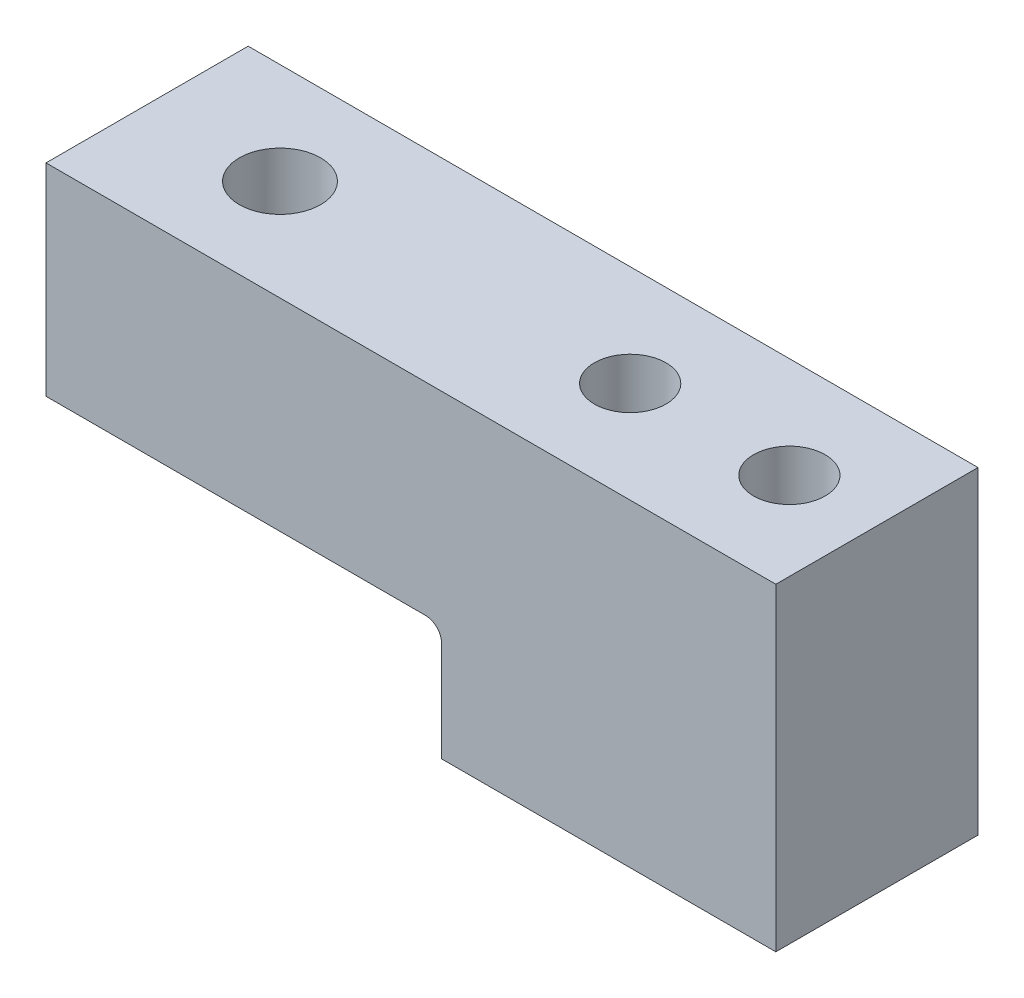
from build123d import *

# Parameters (mm, degrees)
BOSS_EXTRUDE1_DEPTH         = 12.7
M4_CLEARANCE_HOLE1_D        = 4.5
TAP_DRILL_FOR_1_4_20_TAP1_D = 5.1054


with BuildPart() as part:
    # Sketch1 → Boss-Extrude1 (new body)
    with BuildSketch(Plane.XY):
        with BuildLine():
            Line((0, 0), (21, 0))
            Line((21, 0), (21, 20))
            Line((21, 20), (-24.85, 20))
            Line((-24.85, 20), (-24.85, 7.3))
            Line((-24.85, 7.3), (-1, 7.3))
            ThreePointArc((-1, 7.3), (-0.292893219, 7.007106781), (0, 6.3))
            Line((0, 6.3), (0, 0))
        make_face()
    extrude(amount=BOSS_EXTRUDE1_DEPTH)

    # M4 Clearance Hole1 (through all)
    with Locations(Plane(origin=(0, 20, 0), x_dir=(1, 0, 0), z_dir=(0, 1, 0))):
        with Locations((5.5, -6.35), (15.5, -6.35)):
            Hole(M4_CLEARANCE_HOLE1_D / 2)

    # Tap Drill for 1/4-20 Tap1 (through all)
    with Locations(Plane(origin=(0, 20, 0), x_dir=(1, 0, 0), z_dir=(0, 1, 0))):
        with Locations((-16.5, -6.35)):
            Hole(TAP_DRILL_FOR_1_4_20_TAP1_D / 2)


solid = part.part
